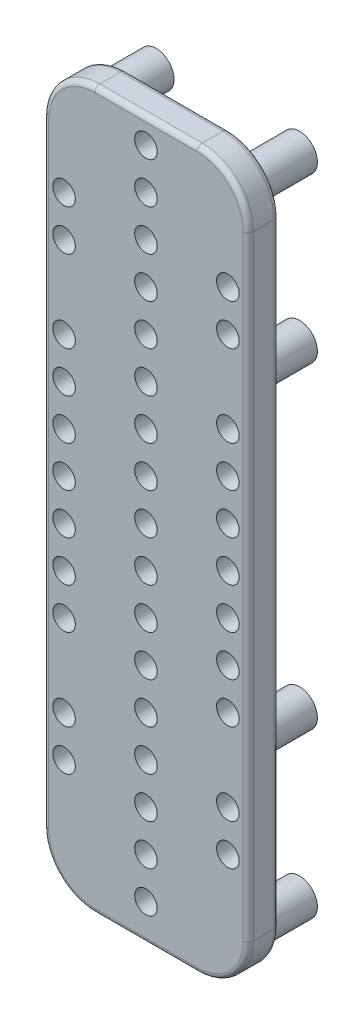
from build123d import *

# Parameters (mm, degrees)
ESQUISSE1_W             = 20
ESQUISSE1_H             = 70
BOSS_EXTRU_1_DEPTH      = 3
ESQUISSE2_R             = 1.75
BOSS_EXTRU_2_DEPTH      = 5
ESQUISSE3_R             = 1.1
ENL_V_MAT_EXTRU_1_DEPTH = 5
CONG_1_R                = 5
CONG_2_R                = 0.5


with BuildPart() as part:
    # Esquisse1 → Boss.-Extru.1 (new body)
    with BuildSketch(Plane.XY):
        with Locations((10, 35)):
            Rectangle(ESQUISSE1_W, ESQUISSE1_H)
    extrude(amount=BOSS_EXTRU_1_DEPTH)

    # Esquisse2 → Boss.-Extru.2 (add)
    with BuildSketch(Plane(origin=(0, 0, 0), x_dir=(-1, 0, 0), z_dir=(0, 0, -1))):
        with Locations((-17, 66.5)):
            Circle(ESQUISSE2_R)
        with Locations((-3, 66.5)):
            Circle(ESQUISSE2_R)
        with Locations((-17, 50.5)):
            Circle(ESQUISSE2_R)
        with Locations((-3, 50.5)):
            Circle(ESQUISSE2_R)
        with Locations((-17, 19.5)):
            Circle(ESQUISSE2_R)
        with Locations((-3, 19.5)):
            Circle(ESQUISSE2_R)
        with Locations((-17, 3.5)):
            Circle(ESQUISSE2_R)
        with Locations((-3, 3.5)):
            Circle(ESQUISSE2_R)
    extrude(amount=BOSS_EXTRU_2_DEPTH)

    # Esquisse3 → Enlèv. mat.-Extru.1 (cut)
    with BuildSketch(Plane.XY.offset(3)):
        with Locations((10, 67.557756062)):
            Circle(ESQUISSE3_R)
        with Locations((10, 3.557756062)):
            Circle(ESQUISSE3_R)
        with Locations((10, 7.557756062)):
            Circle(ESQUISSE3_R)
        with Locations((10, 11.557756062)):
            Circle(ESQUISSE3_R)
        with Locations((10, 15.557756062)):
            Circle(ESQUISSE3_R)
        with Locations((10, 19.557756062)):
            Circle(ESQUISSE3_R)
        with Locations((10, 23.557756062)):
            Circle(ESQUISSE3_R)
        with Locations((10, 27.557756062)):
            Circle(ESQUISSE3_R)
        with Locations((10, 31.557756062)):
            Circle(ESQUISSE3_R)
        with Locations((10, 35.557756062)):
            Circle(ESQUISSE3_R)
        with Locations((10, 39.557756062)):
            Circle(ESQUISSE3_R)
        with Locations((10, 43.557756062)):
            Circle(ESQUISSE3_R)
        with Locations((10, 47.557756062)):
            Circle(ESQUISSE3_R)
        with Locations((10, 51.557756062)):
            Circle(ESQUISSE3_R)
        with Locations((10, 55.557756062)):
            Circle(ESQUISSE3_R)
        with Locations((10, 59.557756062)):
            Circle(ESQUISSE3_R)
        with Locations((10, 63.557756062)):
            Circle(ESQUISSE3_R)
        with Locations((2, 59.557756062)):
            Circle(ESQUISSE3_R)
        with Locations((18, 59.557756062)):
            Circle(ESQUISSE3_R)
        with Locations((2, 55.557756062)):
            Circle(ESQUISSE3_R)
        with Locations((18, 55.557756062)):
            Circle(ESQUISSE3_R)
        with Locations((2, 47.557756062)):
            Circle(ESQUISSE3_R)
        with Locations((18, 47.557756062)):
            Circle(ESQUISSE3_R)
        with Locations((2, 43.557756062)):
            Circle(ESQUISSE3_R)
        with Locations((18, 43.557756062)):
            Circle(ESQUISSE3_R)
        with Locations((2, 39.557756062)):
            Circle(ESQUISSE3_R)
        with Locations((18, 39.557756062)):
            Circle(ESQUISSE3_R)
        with Locations((2, 35.557756062)):
            Circle(ESQUISSE3_R)
        with Locations((18, 35.557756062)):
            Circle(ESQUISSE3_R)
        with Locations((2, 31.557756062)):
            Circle(ESQUISSE3_R)
        with Locations((18, 31.557756062)):
            Circle(ESQUISSE3_R)
        with Locations((2, 27.557756062)):
            Circle(ESQUISSE3_R)
        with Locations((18, 27.557756062)):
            Circle(ESQUISSE3_R)
        with Locations((2, 23.557756062)):
            Circle(ESQUISSE3_R)
        with Locations((18, 23.557756062)):
            Circle(ESQUISSE3_R)
        with Locations((2, 15.557756062)):
            Circle(ESQUISSE3_R)
        with Locations((18, 15.557756062)):
            Circle(ESQUISSE3_R)
        with Locations((2, 11.557756062)):
            Circle(ESQUISSE3_R)
        with Locations((18, 11.557756062)):
            Circle(ESQUISSE3_R)
    extrude(amount=-ENL_V_MAT_EXTRU_1_DEPTH, mode=Mode.SUBTRACT)

    # Congé1
    cong_1_edges = [part.edges().sort_by_distance(p)[0] for p in [
        (20, 70, 1.5),
        (20, 0, 1.5),
        (0, 0, 1.5),
        (0, 70, 1.5),
    ]]
    fillet(cong_1_edges, radius=CONG_1_R)

    # Congé2
    cong_2_edges = [part.edges().sort_by_distance(p)[0] for p in [
        (18.535533906, 68.535533906, 0),
        (10, 70, 0),
        (1.464466094, 68.535533906, 0),
        (0, 35, 0),
        (1.464466094, 1.464466094, 0),
        (10, 0, 0),
        (20, 35, 0),
        (18.535533906, 1.464466094, 0),
        (1.464466094, 1.464466094, 3),
        (10, 0, 3),
        (18.535533906, 1.464466094, 3),
        (0, 35, 3),
        (1.464466094, 68.535533906, 3),
        (20, 35, 3),
        (18.535533906, 68.535533906, 3),
        (10, 70, 3),
    ]]
    fillet(cong_2_edges, radius=CONG_2_R)


solid = part.part
